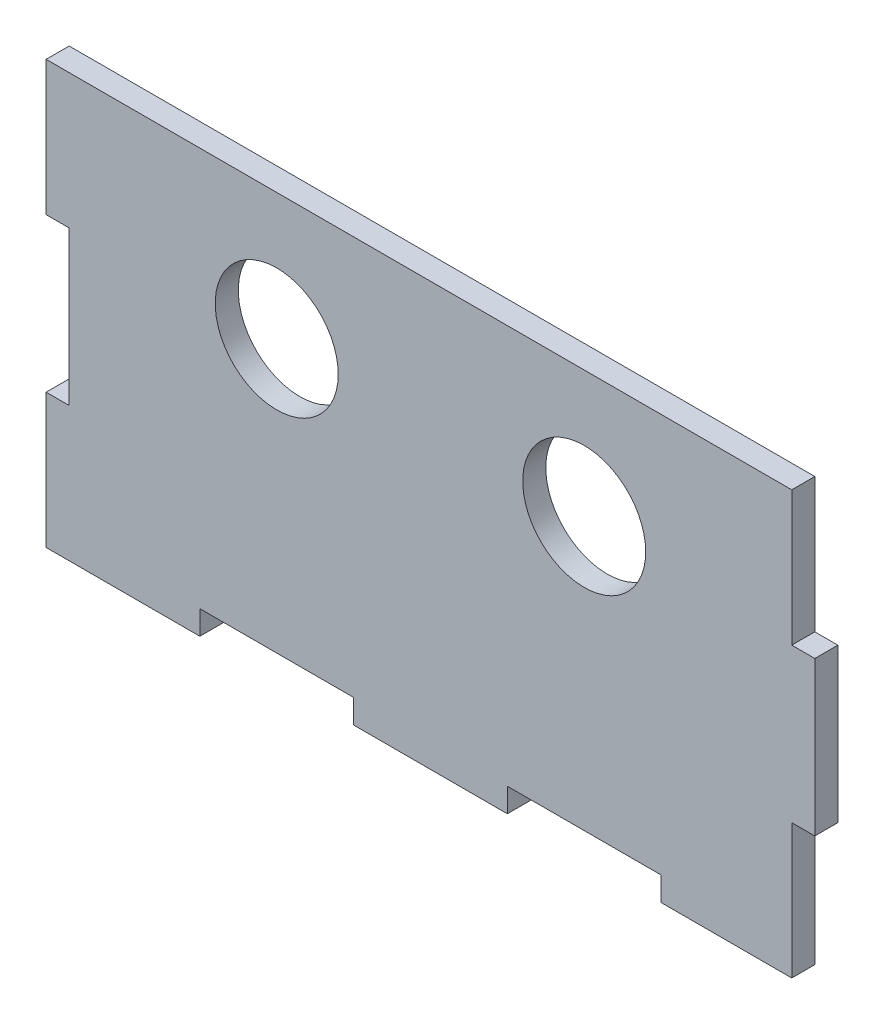
from build123d import *

# Parameters (mm, degrees)
SKETCH1_R           = 8
BOSS_EXTRUDE1_DEPTH = 3


with BuildPart() as part:
    # Sketch1 → Boss-Extrude1 (new body)
    with BuildSketch(Plane.XY):
        Polygon((-50, -10), (-50, -27.5), (-30, -27.5), (-30, -24.393503037), (-10, -24.393503037), (-10, -27.5), (10, -27.5), (10, -24.393503037), (30, -24.393503037), (30, -27.5), (47, -27.5), (47, -10), (50, -10), (50, 10), (47, 10), (47, 27.5), (-50, 27.5), (-50, 10), (-47, 10), (-47, -10), align=None)
        with Locations((-20, 11)):
            Circle(SKETCH1_R, mode=Mode.SUBTRACT)
        with Locations((20, 11)):
            Circle(SKETCH1_R, mode=Mode.SUBTRACT)
    extrude(amount=BOSS_EXTRUDE1_DEPTH)


solid = part.part
